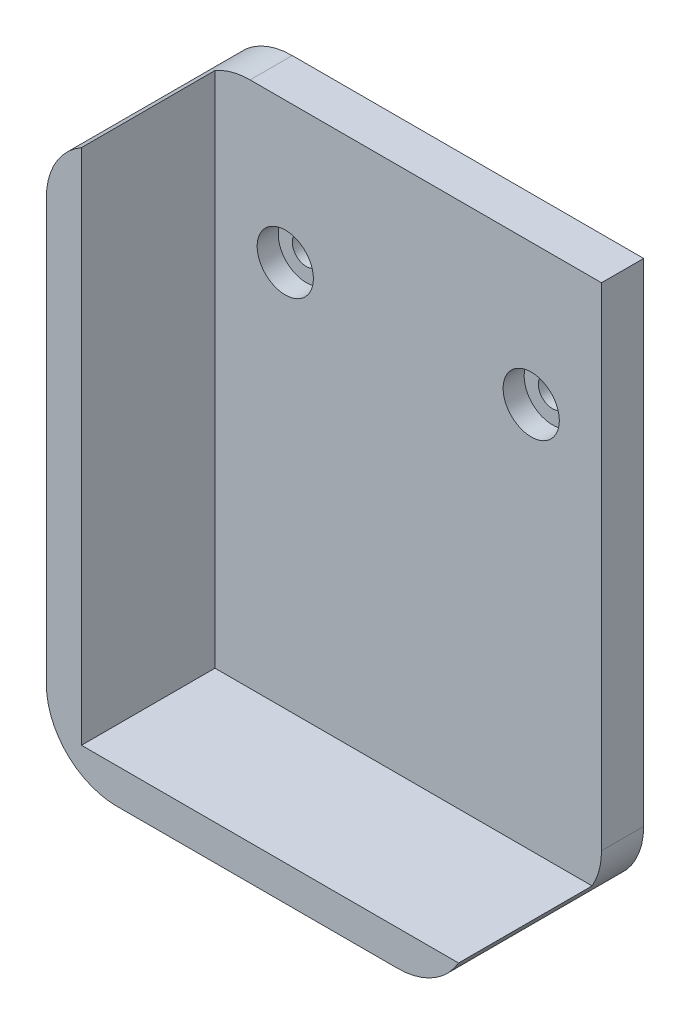
from build123d import *

# Parameters (mm, degrees)
SKETCH1_W           = 60
SKETCH1_H           = 80
BOSS_EXTRUDE4_DEPTH = 6
BOSS_EXTRUDE5_DEPTH = 25
SKETCH1_15_R        = 2
CUT_EXTRUDE1_DEPTH  = 25
SKETCH1_16_R        = 4
SKETCH1_16_R_2      = 2
CUT_EXTRUDE2_DEPTH  = 25
SKETCH1_18_R        = 4
SKETCH1_18_R_2      = 2
BOSS_EXTRUDE7_DEPTH = 3
FILLET1_R           = 10


with BuildPart() as part:
    # Sketch1 → Boss-Extrude4 (new body)
    with BuildSketch(Plane.XY):
        with Locations((30, 40)):
            Rectangle(SKETCH1_W, SKETCH1_H)
    extrude(amount=BOSS_EXTRUDE4_DEPTH)

    # Sketch1<12> → Boss-Extrude5 (add)
    with BuildSketch(Plane.XY):
        Polygon((5, 5), (5, 80), (0, 80), (0, 0), (60, 0), (60, 5), align=None)
    extrude(amount=BOSS_EXTRUDE5_DEPTH)

    # Sketch1<15> → Cut-Extrude1 (cut)
    with BuildSketch(Plane.XY):
        with Locations((50, 60)):
            Circle(SKETCH1_15_R)
        with Locations((15, 60)):
            Circle(SKETCH1_15_R)
    extrude(amount=CUT_EXTRUDE1_DEPTH, mode=Mode.SUBTRACT)

    # Sketch1<16> → Cut-Extrude2 (cut)
    # profile 1 of 2: a face of its own
    with BuildSketch(Plane.XY):
        with Locations((15, 60)):
            Circle(SKETCH1_16_R)
        with Locations((15, 60)):
            Circle(SKETCH1_16_R_2, mode=Mode.SUBTRACT)
    # profile 2 of 2: a face of its own
    with BuildSketch(Plane.XY):
        with Locations((50, 60)):
            Circle(SKETCH1_16_R)
        with Locations((50, 60)):
            Circle(SKETCH1_16_R_2, mode=Mode.SUBTRACT)
    extrude(amount=CUT_EXTRUDE2_DEPTH, mode=Mode.SUBTRACT)

    # Sketch1<18> → Boss-Extrude7 (add)
    # profile 1 of 2: a face of its own
    with BuildSketch(Plane.XY):
        with Locations((15, 60)):
            Circle(SKETCH1_18_R)
        with Locations((15, 60)):
            Circle(SKETCH1_18_R_2, mode=Mode.SUBTRACT)
    # profile 2 of 2: a face of its own
    with BuildSketch(Plane.XY):
        with Locations((50, 60)):
            Circle(SKETCH1_18_R)
        with Locations((50, 60)):
            Circle(SKETCH1_18_R_2, mode=Mode.SUBTRACT)
    extrude(amount=BOSS_EXTRUDE7_DEPTH)

    # Fillet1
    fillet1_edges = [part.edges().sort_by_distance(p)[0] for p in [
        (60, 0, 12.5),
        (0, 80, 12.5),
        (0, 0, 12.5),
    ]]
    fillet(fillet1_edges, radius=FILLET1_R)


solid = part.part
